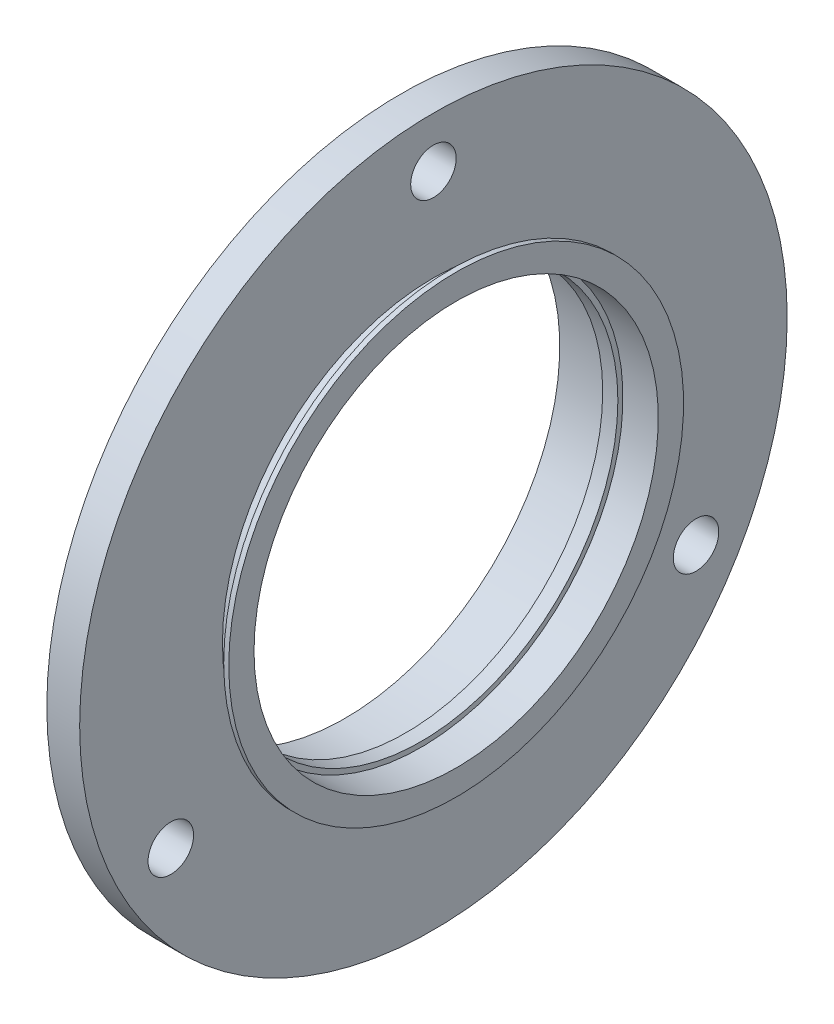
from build123d import *

# Parameters (mm, degrees)
SCHIZZO2_R               = 4.5
TAGLIO_ESTRUSIONE1_DEPTH = 100.604216778


with BuildPart() as part:
    # Schizzo1 → Rivoluzione1 (revolve)
    with BuildSketch(Plane.XY, mode=Mode.PRIVATE) as rivoluzione1_sk:
        Polygon((0, 40), (0, 45), (-1, 45), (-1, 41.75), (-4.5, 41.75), (-4.5, 70), (-11, 70), (-11, 47.5), (-22, 47.5), (-22, 42.5), (-10, 42.5), (-10, 39), (-7, 39), (-7, 40), align=None)
    revolve(rivoluzione1_sk.sketch.rotate(Axis((-54.554939241, 0, 0), (1, 0, 0)), 90), axis=Axis((-54.554939241, 0, 0), (1, 0, 0)))

    # Schizzo2 → Taglio-Estrusione1 (cut, through all)
    with BuildSketch(Plane.ZY.offset(11)):
        with Locations((0, 60)):
            Circle(SCHIZZO2_R)
        with Locations((51.961524227, -30)):
            Circle(SCHIZZO2_R)
        with Locations((-51.961524227, -30)):
            Circle(SCHIZZO2_R)
    extrude(amount=-TAGLIO_ESTRUSIONE1_DEPTH, mode=Mode.SUBTRACT)


solid = part.part
